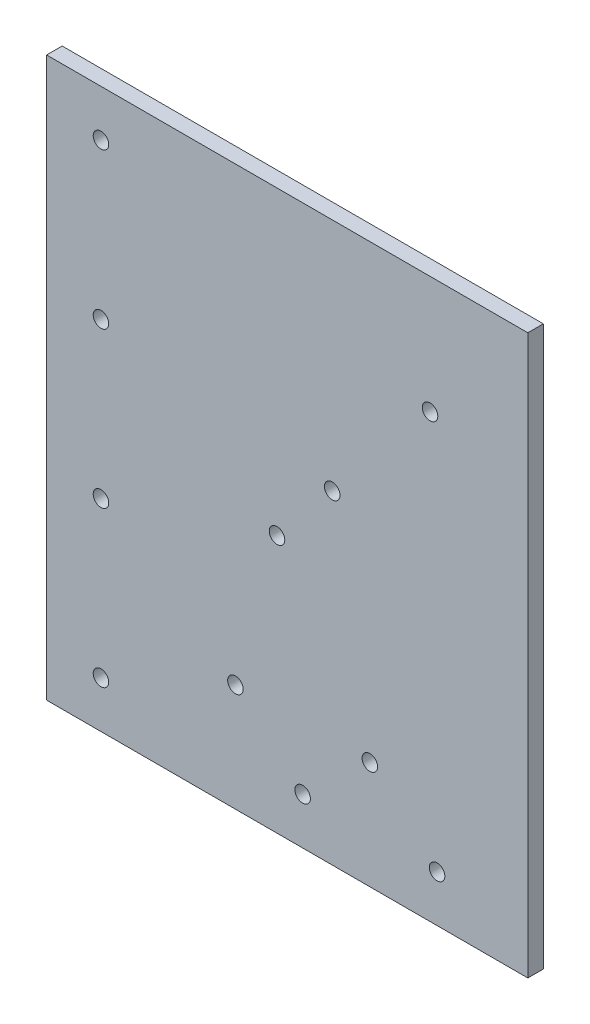
from build123d import *

# Parameters (mm, degrees)
SKETCH1_W                 = 393.7
SKETCH1_H                 = 457.2
PLATE_DEPTH               = 12.7
PATTERN_LINEAR_1020_COUNT = 4
PATTERN_LINEAR_1020_PITCH = 127


with BuildPart() as part:
    # Sketch1 → Plate (new body)
    with BuildSketch(Plane.XY):
        with Locations((196.85, 228.6)):
            Rectangle(SKETCH1_W, SKETCH1_H)
    extrude(amount=PLATE_DEPTH)

    # Sketch3 → Hole (revolve, cut)
    with BuildSketch(Plane(origin=(44.45, 38.1, 12.7), x_dir=(0, -1, 0), z_dir=(1, 0, 0))):
        Polygon((0, 0), (0, 29.215464931), (6.35, 25.4), (6.35, 0), align=None)
    hole = revolve(axis=Axis((44.45, 38.1, 19.05), (0, 0, -1)), mode=Mode.SUBTRACT)

    # Pattern Linear 1020: Hole ×4
    with Locations(*[(0, i * PATTERN_LINEAR_1020_PITCH, 0) for i in range(1, PATTERN_LINEAR_1020_COUNT)]):
        add(hole, mode=Mode.SUBTRACT)

    # 草圖複製排列1: Hole at 3 more places
    with Locations((189.2039, 227.04468, 0), (269.22695, 323.07234, 0), (144.04149, 172.849788, 0)):
        add(hole, mode=Mode.SUBTRACT)

    # 草圖複製排列2: Hole at 4 more places
    with Locations((165, 0, 0), (275, 0, 0), (110, 50, 0), (220, 50, 0)):
        add(hole, mode=Mode.SUBTRACT)


solid = part.part
